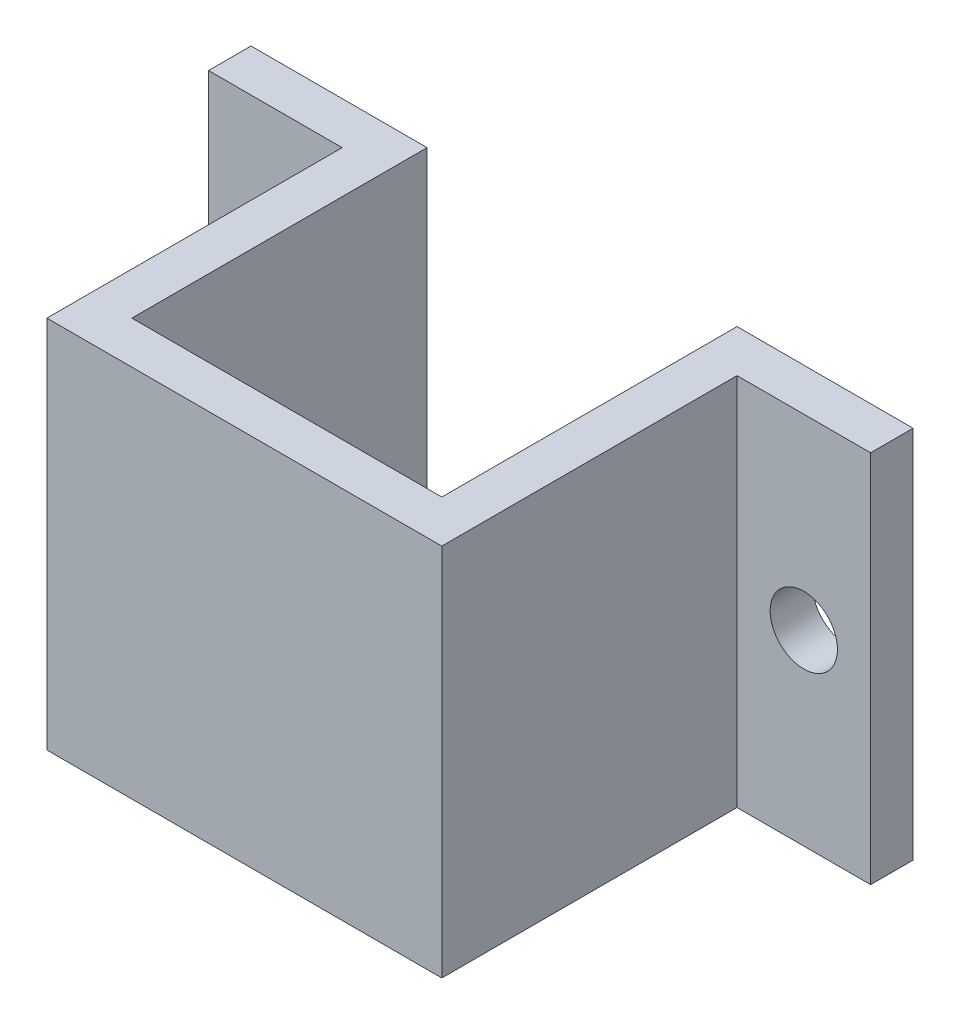
from build123d import *

# Parameters (mm, degrees)
BOSS_EXTRUDE1_DEPTH = 14
SKETCH2_R           = 1.259114001
CUT_EXTRUDE1_DEPTH  = 14


with BuildPart() as part:
    # Sketch1 → Boss-Extrude1 (new body)
    with BuildSketch(Plane(origin=(0, 0, 0), x_dir=(1, 0, 0), z_dir=(0, 1, 0))):
        Polygon((-7.39, 0), (7.39, 0), (7.39, 11.05), (12.39, 11.05), (12.39, 12.64), (5.8, 12.64), (5.8, 1.59), (-5.8, 1.59), (-5.8, 12.64), (-12.39, 12.64), (-12.39, 11.05), (-7.39, 11.05), align=None)
    extrude(amount=BOSS_EXTRUDE1_DEPTH)

    # Sketch2 → Cut-Extrude1 (cut)
    with BuildSketch(Plane.XY.offset(-11.05)):
        with Locations((-9.89, 7)):
            Circle(SKETCH2_R)
        with Locations((9.89, 7)):
            Circle(SKETCH2_R)
    extrude(amount=-CUT_EXTRUDE1_DEPTH, mode=Mode.SUBTRACT)


solid = part.part
